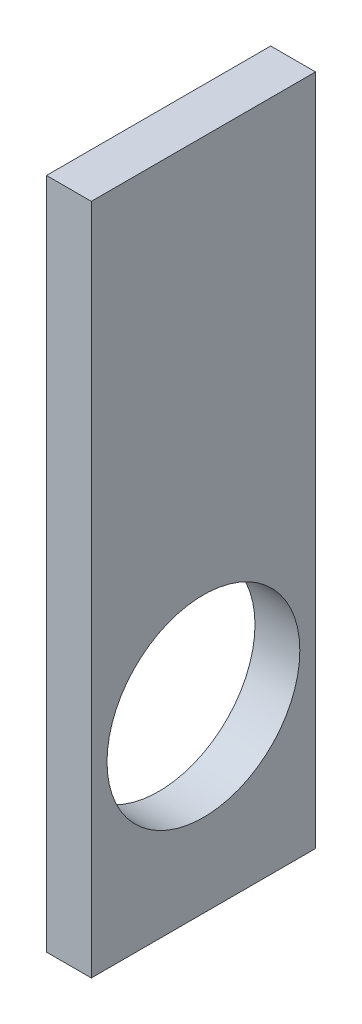
from build123d import *

# Parameters (mm, degrees)
SKETCH1_W           = 10
SKETCH1_H           = 50
BOSS_EXTRUDE1_DEPTH = 150
SKETCH2_R           = 21.5
CUT_EXTRUDE1_DEPTH  = 150


with BuildPart() as part:
    # Sketch1 → Boss-Extrude1 (new body)
    with BuildSketch(Plane(origin=(0, 0, 0), x_dir=(1, 0, 0), z_dir=(0, 1, 0))):
        Rectangle(SKETCH1_W, SKETCH1_H)
    extrude(amount=BOSS_EXTRUDE1_DEPTH)

    # Sketch2 → Cut-Extrude1 (cut)
    with BuildSketch(Plane(origin=(5, 0, 0), x_dir=(0, 0, -1), z_dir=(1, 0, 0))):
        with Locations((0, 40)):
            Circle(SKETCH2_R)
    extrude(amount=-CUT_EXTRUDE1_DEPTH, mode=Mode.SUBTRACT)


solid = part.part
